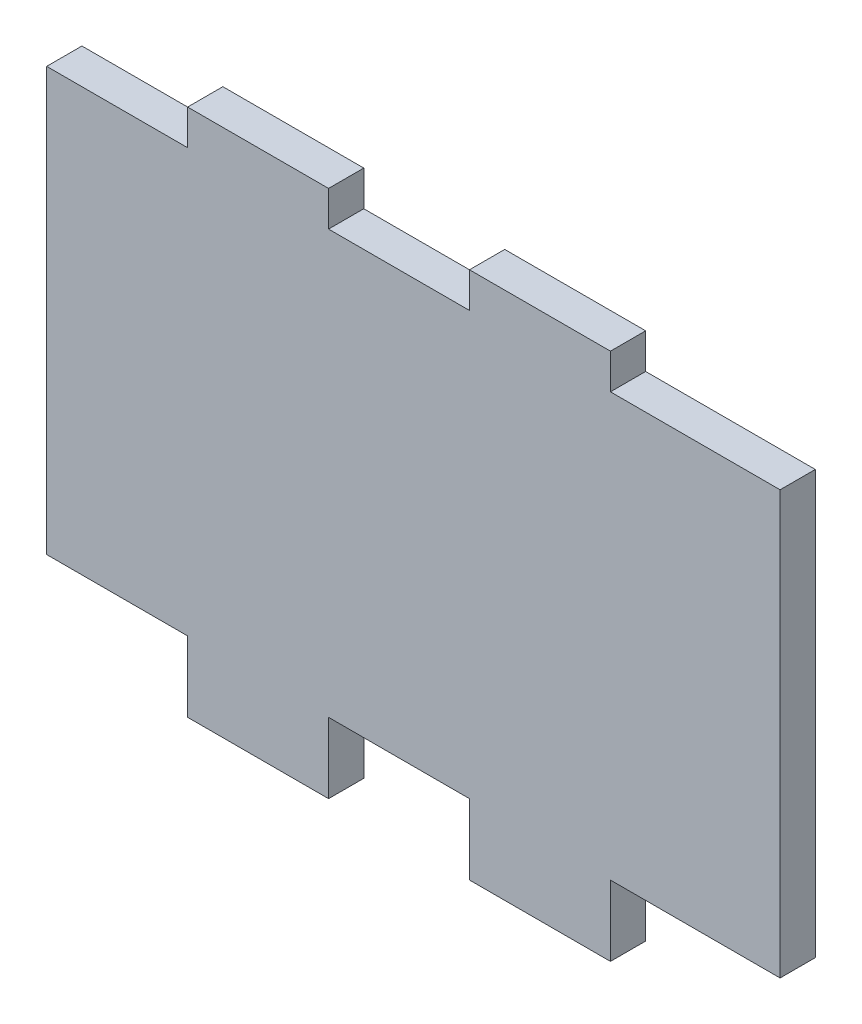
from build123d import *

# Parameters (mm, degrees)
BOSS_EXTRUDE1_DEPTH = 2.5


with BuildPart() as part:
    # Sketch1 → Boss-Extrude1 (new body)
    with BuildSketch(Plane.XY):
        Polygon((-26.018829265, 16.25), (-16.018829265, 16.25), (-16.018829265, 18.75), (-6.018829265, 18.75), (-6.018829265, 16.25), (3.981170735, 16.25), (3.981170735, 18.75), (13.981170735, 18.75), (13.981170735, 16.25), (26.018829265, 16.25), (26.018829265, -13.75), (13.981170735, -13.75), (13.981170735, -18.75), (3.981170735, -18.75), (3.981170735, -13.75), (-6.018829265, -13.75), (-6.018829265, -18.75), (-16.018829265, -18.75), (-16.018829265, -13.75), (-26.018829265, -13.75), align=None)
    extrude(amount=BOSS_EXTRUDE1_DEPTH)


solid = part.part
